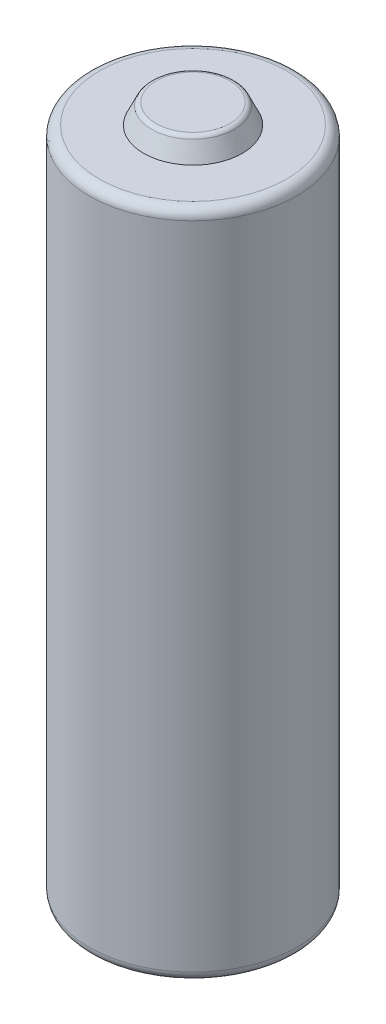
from build123d import *

# Parameters (mm, degrees)
SKETCH1_R           = 10.5
BOSS_EXTRUDE1_DEPTH = 68
SKETCH2_R           = 4.997387286
BOSS_EXTRUDE2_DEPTH = 2
BOSS_EXTRUDE2_TAPER = 25
SKETCH3_R           = 7.00167494
SKETCH3_R_2         = 6.004433393
CUT_EXTRUDE1_DEPTH  = 3
CUT_EXTRUDE1_TAPER  = 25
FILLET1_R           = 1
FILLET2_R           = 0.5
FILLET3_R           = 1


with BuildPart() as part:
    # Sketch1 → Boss-Extrude1 (new body)
    with BuildSketch(Plane(origin=(0, 0, 0), x_dir=(1, 0, 0), z_dir=(0, 1, 0))):
        with Locations(Location((0, 0, 0), (0, 0, 270))):
            Circle(SKETCH1_R)
    extrude(amount=BOSS_EXTRUDE1_DEPTH)

    # Sketch2 → Boss-Extrude2 (add)
    with BuildSketch(Plane(origin=(0, 68, 0), x_dir=(1, 0, 0), z_dir=(0, 1, 0))):
        Circle(SKETCH2_R)
    extrude(amount=BOSS_EXTRUDE2_DEPTH, taper=BOSS_EXTRUDE2_TAPER)

    # Sketch3 → Cut-Extrude1 (cut)
    with BuildSketch(Plane.XZ):
        Circle(SKETCH3_R)
        Circle(SKETCH3_R_2, mode=Mode.SUBTRACT)
    extrude(amount=-CUT_EXTRUDE1_DEPTH, taper=CUT_EXTRUDE1_TAPER, mode=Mode.SUBTRACT)

    # Fillet1
    fillet1_edges = [part.edges().sort_by_distance(p)[0] for p in [
        (0, 68, -10.5),
    ]]
    fillet(fillet1_edges, radius=FILLET1_R)

    # Fillet2
    fillet2_edges = [part.edges().sort_by_distance(p)[0] for p in [
        (-4.064771969, 70, 0),
    ]]
    fillet(fillet2_edges, radius=FILLET2_R)

    # Fillet3
    fillet3_edges = [part.edges().sort_by_distance(p)[0] for p in [
        (0, 0, -10.5),
    ]]
    fillet(fillet3_edges, radius=FILLET3_R)


solid = part.part
